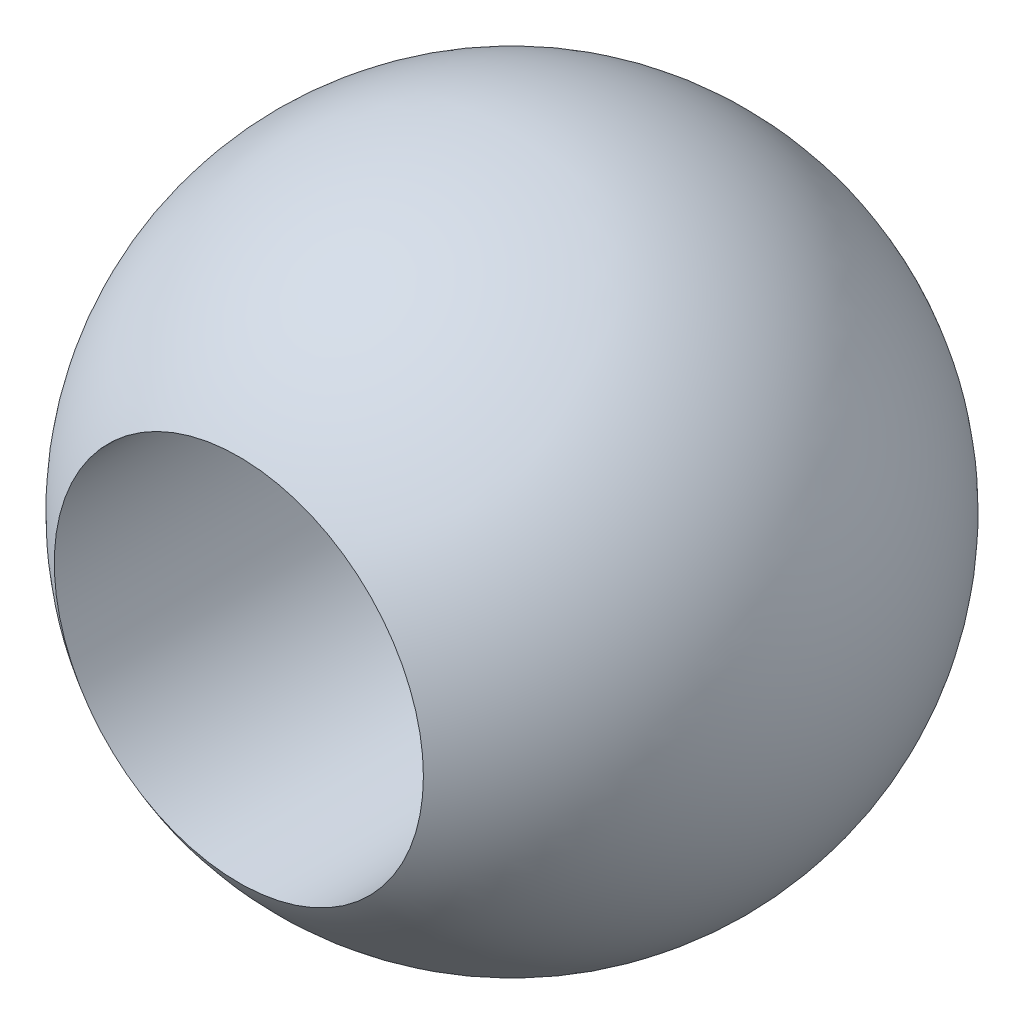
from build123d import *

# Parameters (mm, degrees)
CUT_EXTRUDE1_DEPTH      = 25.746675913
CUT_EXTRUDE1_DEPTH_BACK = 25.746675913
SKETCH3_R               = 8


with BuildPart() as part:
    # Sketch2 → Revolve1 (revolve)
    with BuildSketch(Plane.XY):
        with BuildLine():
            Line((0, 14.2875), (0, -14.2875))
            ThreePointArc((0, -14.2875), (14.2875, 0), (0, 14.2875))
        make_face()
    revolve(axis=Axis((0, -1000, 0), (0, 1, 0)))

    # Sketch3 → Cut-Extrude1 (cut, two sides: drawn at the far end of the back side and taken through both)
    with BuildSketch(Plane.XY.offset(-CUT_EXTRUDE1_DEPTH_BACK)):
        Circle(SKETCH3_R)
    extrude(amount=CUT_EXTRUDE1_DEPTH + CUT_EXTRUDE1_DEPTH_BACK, mode=Mode.SUBTRACT)


solid = part.part
